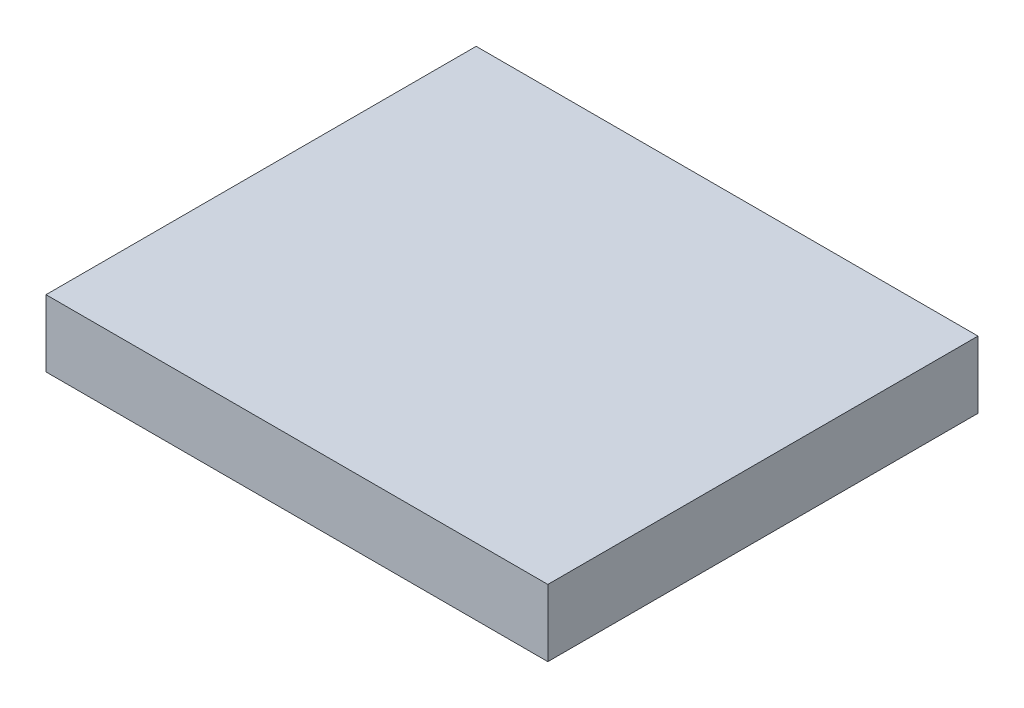
from build123d import *

# Parameters (mm, degrees)
SKETCH1_W           = 20.99999991
SKETCH1_H           = 18
BOSS_EXTRUDE1_DEPTH = 2.8


with BuildPart() as part:
    # Sketch1 → Boss-Extrude1 (new body)
    with BuildSketch(Plane(origin=(0, 0, 0), x_dir=(1, 0, 0), z_dir=(0, 1, 0))):
        with Locations((10.499999955, 9)):
            Rectangle(SKETCH1_W, SKETCH1_H)
    extrude(amount=BOSS_EXTRUDE1_DEPTH)


solid = part.part
